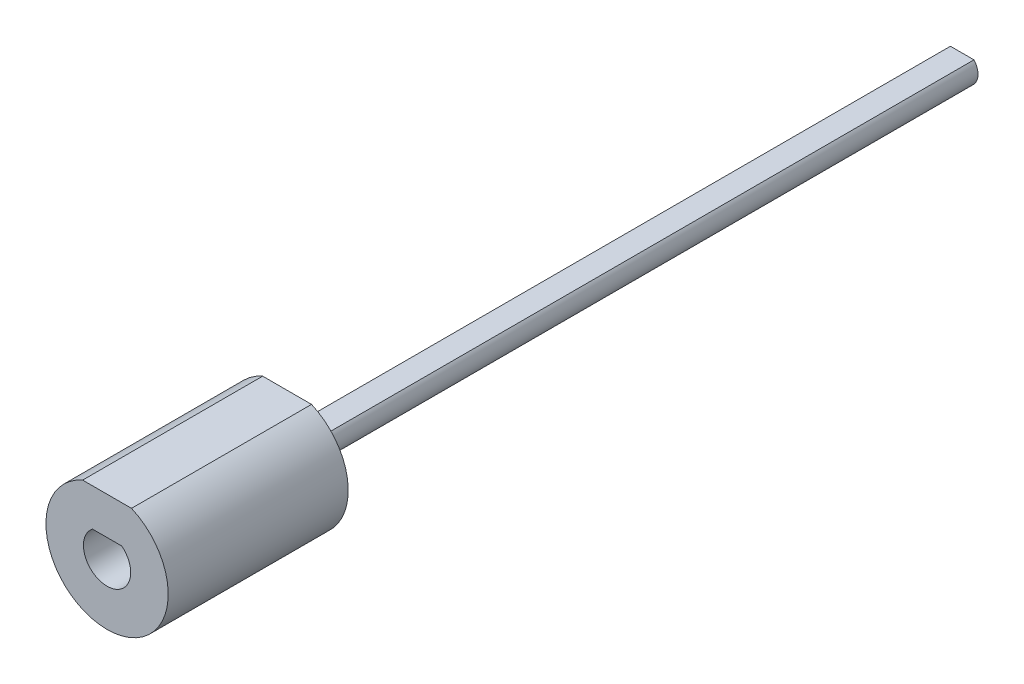
from build123d import *

# Parameters (mm, degrees)
BOSS_EXTRUDE1_DEPTH = 6.35
BOSS_EXTRUDE2_START = 2.54
BOSS_EXTRUDE2_DEPTH = 2.54
BOSS_EXTRUDE4_START = 6.35
SKETCH4_R           = 1.5113
BOSS_EXTRUDE4_DEPTH = 6.35
BOSS_EXTRUDE3_DEPTH = 63.5


with BuildPart() as part:
    # Sketch1 → Boss-Extrude1 (new body)
    with BuildSketch(Plane.XY):
        with BuildLine():
            Line((-2.069463106, 4.743200128), (2.069463106, 4.743200128))
            ThreePointArc((2.069463106, 4.743200128), (0, -5.175), (-2.069463106, 4.743200128))
        make_face()
        with BuildLine():
            Line((-1.24126885, 1.568200128), (1.24126885, 1.568200128))
            ThreePointArc((1.24126885, 1.568200128), (0, -2), (-1.24126885, 1.568200128))
        make_face(mode=Mode.SUBTRACT)
    extrude(amount=BOSS_EXTRUDE1_DEPTH)

    # Sketch3 → Boss-Extrude2 (add)
    with BuildSketch(Plane(origin=(0, 0, 0), x_dir=(-1, 0, 0), z_dir=(0, 0, -1)).offset(BOSS_EXTRUDE2_START)):
        with BuildLine():
            Line((-2.069463106, 4.743200128), (2.069463106, 4.743200128))
            ThreePointArc((2.069463106, 4.743200128), (0, -5.175), (-2.069463106, 4.743200128))
        make_face()
    extrude(amount=-BOSS_EXTRUDE2_DEPTH)

    # Sketch4 → Boss-Extrude4 (add)
    with BuildSketch(Plane(origin=(0, 0, -2.54), x_dir=(-1, 0, 0), z_dir=(0, 0, -1)).offset(BOSS_EXTRUDE4_START)):
        with BuildLine():
            Line((2.069463106, 4.743200128), (-2.069463106, 4.743200128))
            ThreePointArc((-2.069463106, 4.743200128), (0, -5.175), (2.069463106, 4.743200128))
        make_face()
        Circle(SKETCH4_R, mode=Mode.SUBTRACT)
    extrude(amount=-BOSS_EXTRUDE4_DEPTH)

    # Sketch2 → Boss-Extrude3 (add)
    with BuildSketch(Plane(origin=(0, 0, -2.54), x_dir=(-1, 0, 0), z_dir=(0, 0, -1))):
        with BuildLine():
            Line((0.997718624, 0.892386667), (-0.997718624, 0.892386667))
            ThreePointArc((-0.997718624, 0.892386667), (0, -1.33858), (0.997718624, 0.892386667))
        make_face()
    extrude(amount=BOSS_EXTRUDE3_DEPTH)


solid = part.part
